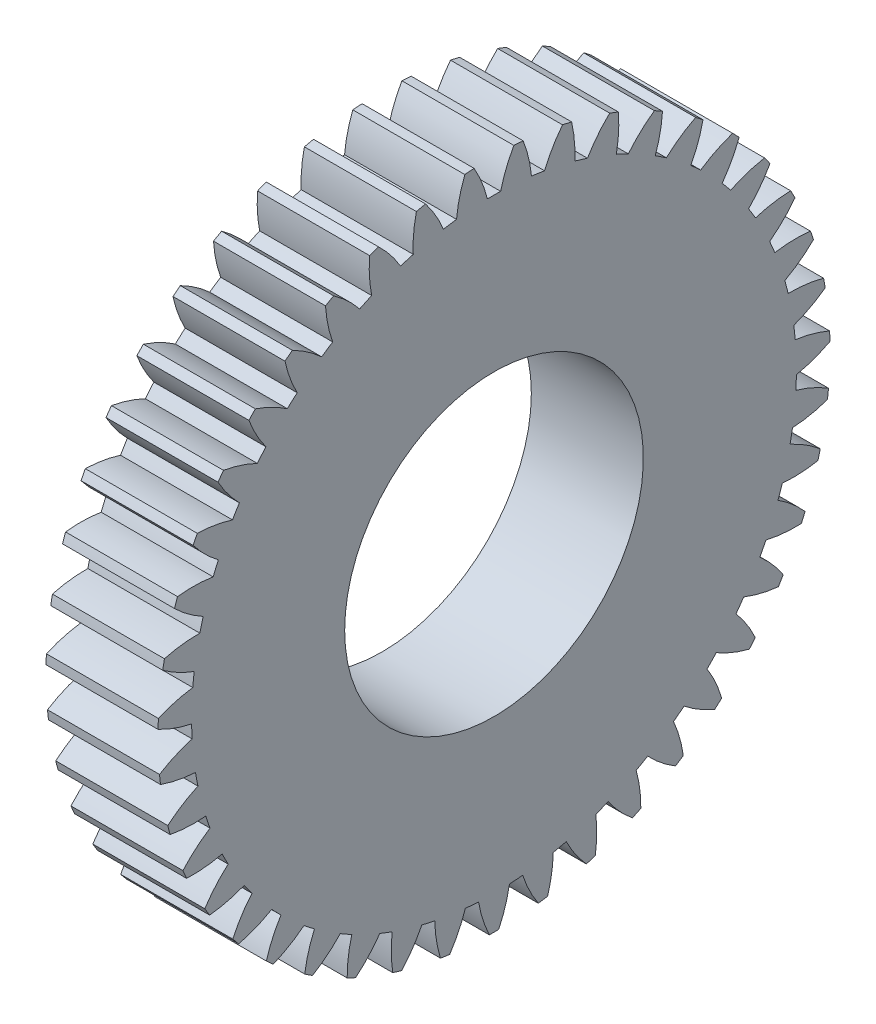
from build123d import *

# Parameters (mm, degrees)
BASPROSKE_W     = 3
BASPROSKE_H     = 9
TOOTHCUT_DEPTH  = 14.076696831
TEETHCUTS_COUNT = 43
TEETHCUTS_ANGLE = 351.627906977
BORSKE_R        = 4
BORE_DEPTH      = 50.0000508


with BuildPart() as part:
    # BasProSke → Base-Revolve (revolve)
    with BuildSketch(Plane(origin=(0, 0, 0), x_dir=(1, 0, 0), z_dir=(0, 1, 0)), mode=Mode.PRIVATE) as base_revolve_sk:
        with Locations((1.5, 4.5)):
            Rectangle(BASPROSKE_W, BASPROSKE_H)
    revolve(base_revolve_sk.sketch.rotate(Axis((-10, 0, 0), (1, 0, 0)), 180), axis=Axis((-10, 0, 0), (1, 0, 0)))

    # TooCutSke → ToothCut (cut, through all)
    with BuildSketch(Plane(origin=(0, 0, 0), x_dir=(0, 0, -1), z_dir=(1, 0, 0))):
        with BuildLine():
            ThreePointArc((0.177469936, 8.097055355), (0, 8.099), (-0.177469936, 8.097055355))
            ThreePointArc((-0.177469936, 8.097055355), (-0.329249996, 8.566205856), (-0.546546154, 9.008836354))
            ThreePointArc((-0.546546154, 9.008836354), (0, 9.0254), (0.546546154, 9.008836354))
            ThreePointArc((0.546546154, 9.008836354), (0.329249996, 8.566205856), (0.177469936, 8.097055355))
        make_face()
    toothcut = extrude(amount=TOOTHCUT_DEPTH, mode=Mode.SUBTRACT)

    # TeethCuts: ToothCut ×43 about axis
    teethcuts_axis = Axis((-10, 0, 0), (1, 0, 0))
    for i in range(1, TEETHCUTS_COUNT):
        add(toothcut.rotate(teethcuts_axis, i * TEETHCUTS_ANGLE / (TEETHCUTS_COUNT - 1)), mode=Mode.SUBTRACT)

    # BorSke → Bore (cut, symmetric)
    with BuildSketch(Plane(origin=(0, 0, 0), x_dir=(0, 0, -1), z_dir=(1, 0, 0))):
        with Locations(Location((0, 0, 0), (0, 0, 180))):
            Circle(BORSKE_R)
    extrude(amount=BORE_DEPTH, both=True, mode=Mode.SUBTRACT)


solid = part.part
